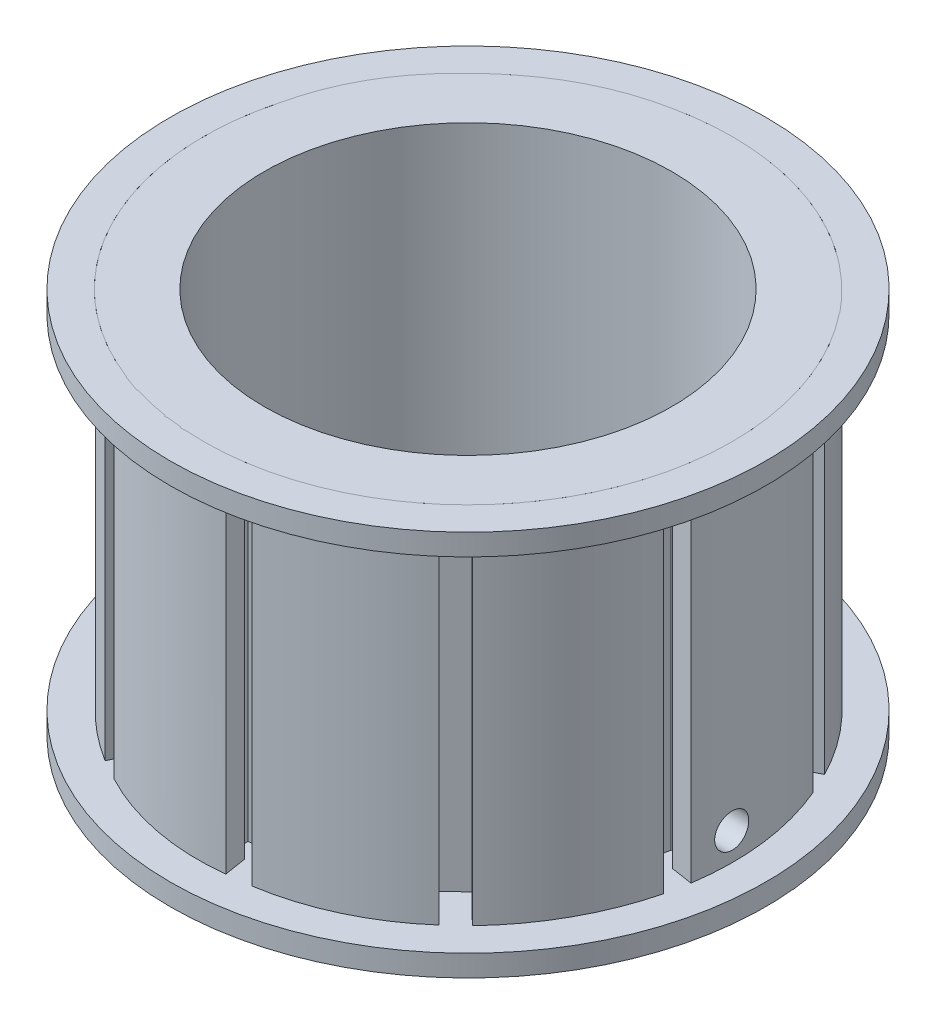
from build123d import *

# Parameters (mm, degrees)
BOSS_EXTRUDE1_DEPTH     = 36
SKETCH7_R               = 19
CUT_EXTRUDE2_DEPTH      = 28
SKETCH8_R               = 24.640257617
SKETCH8_R_2             = 19
BOSS_EXTRUDE2_DEPTH     = 2
BOSS_EXTRUDE3_START     = -2
SKETCH9_R               = 24.765471232
SKETCH9_R_2             = 19
BOSS_EXTRUDE3_DEPTH     = 2
CUT_EXTRUDE4_DEPTH      = 133.195882603
CUT_EXTRUDE4_DEPTH_BACK = 133.195882603
SKETCH12_R              = 1.585
SKETCH17_R              = 27.765471232
BOSS_EXTRUDE4_DEPTH     = 2
SKETCH18_R              = 27.765471232
SKETCH18_R_2            = 24.640257617
BOSS_EXTRUDE5_DEPTH     = 2
SKETCH6_R               = 4
CUT_EXTRUDE1_DEPTH      = 54.271406829


with BuildPart() as part:
    # Sketch5 → Boss-Extrude1 (new body)
    with BuildSketch(Plane(origin=(0, 0, 0), x_dir=(1, 0, 0), z_dir=(0, 1, 0))):
        with BuildLine():
            Line((-24.362984614, 3.572359692), (-22.313286634, 3.256454852))
            Line((-22.313286634, 3.256454852), (-22.526139017, 2.16729886))
            Line((-22.526139017, 2.16729886), (-20.776467593, 1.825362779))
            Line((-20.776467593, 1.825362779), (-19.941416091, 6.131877613))
            Line((-19.941416091, 6.131877613), (-21.677029311, 6.475275507))
            Line((-21.677029311, 6.475275507), (-21.884939056, 5.40533318))
            Line((-21.884939056, 5.40533318), (-23.944192117, 5.722710675))
            ThreePointArc((-23.944192117, 5.722710675), (-21.682866171, 11.965840949), (-17.610288244, 17.210302759))
            Line((-17.610288244, 17.210302759), (-16.137731951, 15.74994813))
            Line((-16.137731951, 15.74994813), (-16.950122975, 14.993913915))
            Line((-16.950122975, 14.993913915), (-15.735594044, 13.688850755))
            Line((-15.735594044, 13.688850755), (-12.52871728, 16.682063485))
            Line((-12.52871728, 16.682063485), (-13.731013652, 17.980046071))
            Line((-13.731013652, 17.980046071), (-14.52811249, 17.236650828))
            Line((-14.52811249, 17.236650828), (-16.007533401, 18.703813195))
            ThreePointArc((-16.007533401, 18.703813195), (-10.474304885, 22.352615221), (-4.131060316, 24.274495129))
            Line((-4.131060316, 24.274495129), (-3.798112164, 22.227496544))
            Line((-3.798112164, 22.227496544), (-4.89973607, 22.093363479))
            Line((-4.89973607, 22.093363479), (-4.684258404, 20.32366301))
            Line((-4.684258404, 20.32366301), (-0.330474303, 20.860268108))
            Line((-0.330474303, 20.860268108), (-0.540217479, 22.617050155))
            Line((-0.540217479, 22.617050155), (-1.622040745, 22.484153711))
            Line((-1.622040745, 22.484153711), (-1.956541002, 24.540694793))
            ThreePointArc((-1.956541002, 24.540694793), (4.651309478, 24.170837782), (10.926092243, 22.066655419))
            Line((10.926092243, 22.066655419), (9.992257377, 20.214896763))
            Line((9.992257377, 20.214896763), (9.022183477, 20.753899119))
            Line((9.022183477, 20.753899119), (8.156304735, 19.19552677))
            Line((8.156304735, 19.19552677), (11.993998625, 17.070559328))
            Line((11.993998625, 17.070559328), (12.85692341, 18.615109805))
            Line((12.85692341, 18.615109805), (11.903595433, 19.143474085))
            Line((11.903595433, 19.143474085), (12.841783559, 21.003865088))
            ThreePointArc((12.841783559, 21.003865088), (18.005151406, 16.85334037), (21.809848929, 11.430103357))
            Line((21.809848929, 11.430103357), (19.965924224, 10.480893498))
            Line((19.965924224, 10.480893498), (19.49793559, 11.487150696))
            Line((19.49793559, 11.487150696), (17.881436687, 10.735351737))
            Line((17.881436687, 10.735351737), (19.73717174, 6.760477092))
            Line((19.73717174, 6.760477092), (21.343156548, 7.502830214))
            Line((21.343156548, 7.502830214), (20.882462745, 8.490638021))
            Line((20.882462745, 8.490638021), (22.734983277, 9.444272814))
            ThreePointArc((22.734983277, 9.444272814), (24.455073827, 3.049281996), (24.362984614, -3.572359692))
            Line((24.362984614, -3.572359692), (22.313286634, -3.256454852))
            Line((22.313286634, -3.256454852), (22.526139017, -2.16729886))
            Line((22.526139017, -2.16729886), (20.776467593, -1.825362779))
            Line((20.776467593, -1.825362779), (19.941416091, -6.131877613))
            Line((19.941416091, -6.131877613), (21.677029311, -6.475275507))
            Line((21.677029311, -6.475275507), (21.884939056, -5.40533318))
            Line((21.884939056, -5.40533318), (23.944192117, -5.722710675))
            ThreePointArc((23.944192117, -5.722710675), (21.522464999, -11.877400691), (17.610288244, -17.210302759))
            Line((17.610288244, -17.210302759), (16.137731951, -15.74994813))
            Line((16.137731951, -15.74994813), (16.950122975, -14.993913915))
            Line((16.950122975, -14.993913915), (15.735594044, -13.688850755))
            Line((15.735594044, -13.688850755), (12.52871728, -16.682063485))
            Line((12.52871728, -16.682063485), (13.731013652, -17.980046071))
            Line((13.731013652, -17.980046071), (14.52811249, -17.236650828))
            Line((14.52811249, -17.236650828), (16.007533401, -18.703813195))
            ThreePointArc((16.007533401, -18.703813195), (10.467433433, -22.337965558), (4.131060316, -24.274495129))
            Line((4.131060316, -24.274495129), (3.798112164, -22.227496544))
            Line((3.798112164, -22.227496544), (4.89973607, -22.093363479))
            Line((4.89973607, -22.093363479), (4.684258404, -20.32366301))
            Line((4.684258404, -20.32366301), (0.330474303, -20.860268108))
            Line((0.330474303, -20.860268108), (0.540217479, -22.617050155))
            Line((0.540217479, -22.617050155), (1.622040745, -22.484153711))
            Line((1.622040745, -22.484153711), (1.956541002, -24.540694793))
            ThreePointArc((1.956541002, -24.540694793), (-4.670838102, -24.272525776), (-10.926092243, -22.066655419))
            Line((-10.926092243, -22.066655419), (-9.992257377, -20.214896763))
            Line((-9.992257377, -20.214896763), (-9.022183477, -20.753899119))
            Line((-9.022183477, -20.753899119), (-8.156304735, -19.19552677))
            Line((-8.156304735, -19.19552677), (-11.993998625, -17.070559328))
            Line((-11.993998625, -17.070559328), (-12.85692341, -18.615109805))
            Line((-12.85692341, -18.615109805), (-11.903595433, -19.143474085))
            Line((-11.903595433, -19.143474085), (-12.841783559, -21.003865088))
            ThreePointArc((-12.841783559, -21.003865088), (-17.951040918, -16.802653253), (-21.809848929, -11.430103357))
            Line((-21.809848929, -11.430103357), (-19.965924224, -10.480893498))
            Line((-19.965924224, -10.480893498), (-19.49793559, -11.487150696))
            Line((-19.49793559, -11.487150696), (-17.881436687, -10.735351737))
            Line((-17.881436687, -10.735351737), (-19.73717174, -6.760477092))
            Line((-19.73717174, -6.760477092), (-21.343156548, -7.502830214))
            Line((-21.343156548, -7.502830214), (-20.882462745, -8.490638021))
            Line((-20.882462745, -8.490638021), (-22.734983277, -9.444272814))
            ThreePointArc((-22.734983277, -9.444272814), (-24.450836742, -3.04875206), (-24.362984614, 3.572359692))
        make_face()
    extrude(amount=BOSS_EXTRUDE1_DEPTH)

    # Sketch7 → Cut-Extrude2 (cut)
    with BuildSketch(Plane(origin=(0, 36, 0), x_dir=(1, 0, 0), z_dir=(0, 1, 0))):
        with Locations(Location((0, 0, 0), (0, 0, 270))):
            Circle(SKETCH7_R)
    extrude(amount=-CUT_EXTRUDE2_DEPTH, mode=Mode.SUBTRACT)

    # Sketch8 → Boss-Extrude2 (add)
    with BuildSketch(Plane(origin=(0, 36, 0), x_dir=(1, 0, 0), z_dir=(0, 1, 0))):
        Circle(SKETCH8_R)
        with Locations(Location((0, 0, 0), (0, 0, 270))):
            Circle(SKETCH8_R_2, mode=Mode.SUBTRACT)
    extrude(amount=-BOSS_EXTRUDE2_DEPTH)

    # Sketch9 → Boss-Extrude3 (add)
    with BuildSketch(Plane.XZ.offset(BOSS_EXTRUDE3_START)):
        with Locations(Location((0, 0, 0), (0, 0, 270))):
            Circle(SKETCH9_R)
        with Locations(Location((0, 0, 0), (0, 0, 90))):
            Circle(SKETCH9_R_2, mode=Mode.SUBTRACT)
    extrude(amount=BOSS_EXTRUDE3_DEPTH)

    # Sketch12 → Cut-Extrude4 (cut, two sides: drawn at the far end of the back side and taken through both)
    with BuildSketch(Plane(origin=(100, 0, 0), x_dir=(0, 0, -1), z_dir=(1, 0, 0)).offset(-CUT_EXTRUDE4_DEPTH_BACK)):
        with Locations((0, 4.59852315)):
            Circle(SKETCH12_R)
    extrude(amount=CUT_EXTRUDE4_DEPTH + CUT_EXTRUDE4_DEPTH_BACK, mode=Mode.SUBTRACT)

    # Sketch17 → Boss-Extrude4 (add)
    with BuildSketch(Plane.XZ):
        with Locations(Location((0, 0, 0), (0, 0, 270))):
            Circle(SKETCH17_R)
    extrude(amount=-BOSS_EXTRUDE4_DEPTH)

    # Sketch6 → Cut-Extrude1 (cut, through all)
    with BuildSketch(Plane(origin=(0, 36, 0), x_dir=(1, 0, 0), z_dir=(0, 1, 0))):
        with Locations(Location((0, 0, 0), (0, 0, 270))):
            Circle(SKETCH6_R)
    extrude(amount=-CUT_EXTRUDE1_DEPTH, mode=Mode.SUBTRACT)


with BuildPart() as body_2:
    # Sketch18 → Boss-Extrude5 (new body)
    with BuildSketch(Plane(origin=(0, 36, 0), x_dir=(1, 0, 0), z_dir=(0, 1, 0))):
        with Locations(Location((0, 0, 0), (0, 0, 270))):
            Circle(SKETCH18_R)
        with Locations(Location((0, 0, 0), (0, 0, 270))):
            Circle(SKETCH18_R_2, mode=Mode.SUBTRACT)
    extrude(amount=-BOSS_EXTRUDE5_DEPTH)


solid = Compound([part.part, body_2.part])
